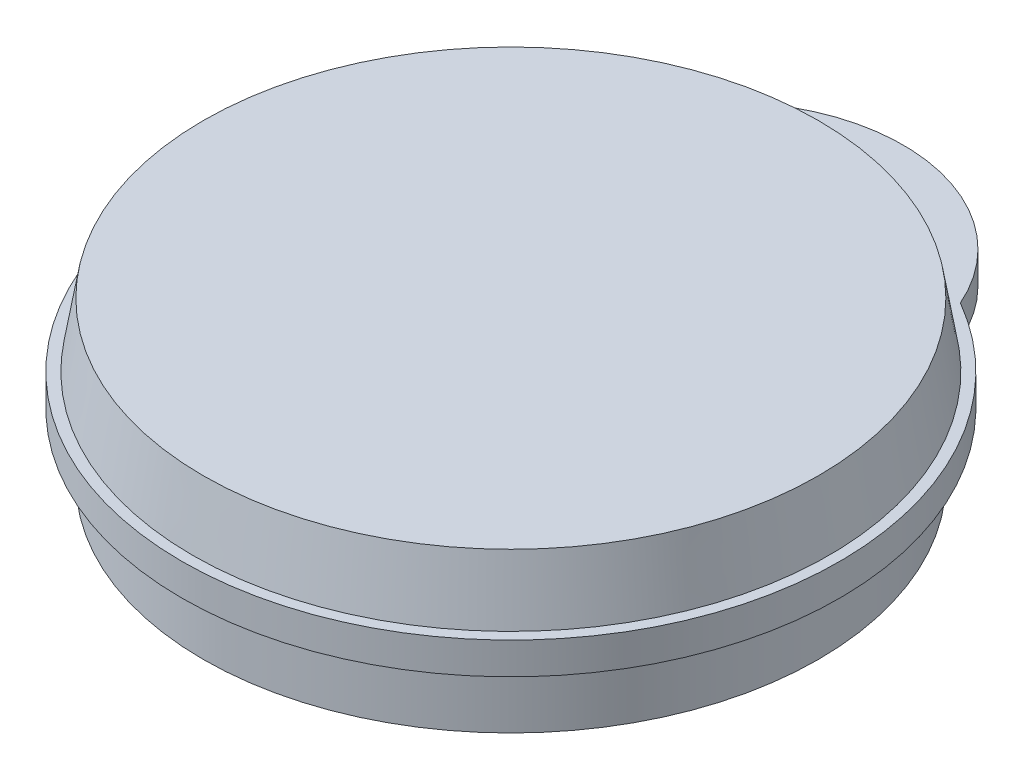
from build123d import *

# Parameters (mm, degrees)
BOSS_EXTRUDE1_DEPTH = 1.5


with BuildPart() as part:
    # Sketch1 → Revolve1 (revolve)
    with BuildSketch(Plane.XY, mode=Mode.PRIVATE) as revolve1_sk:
        Polygon((0, 0), (14.5, 0), (14.5, 3), (15.5, 3), (15.5, 4.5), (15, 4.5), (14.5, 7.5), (0, 7.5), align=None)
    revolve(revolve1_sk.sketch.rotate(Axis((0, 7.5, 0), (0, -1, 0)), 90), axis=Axis((0, 7.5, 0), (0, -1, 0)))

    # Sketch2 → Boss-Extrude1 (add)
    with BuildSketch(Plane(origin=(0, 4.5, 0), x_dir=(1, 0, 0), z_dir=(0, 1, 0))):
        with BuildLine():
            ThreePointArc((8.080445146, 12.6375), (0, 18.5), (-8.080445146, 12.6375))
            ThreePointArc((-8.080445146, 12.6375), (0, 15), (8.080445146, 12.6375))
        make_face()
    extrude(amount=-BOSS_EXTRUDE1_DEPTH)


solid = part.part
